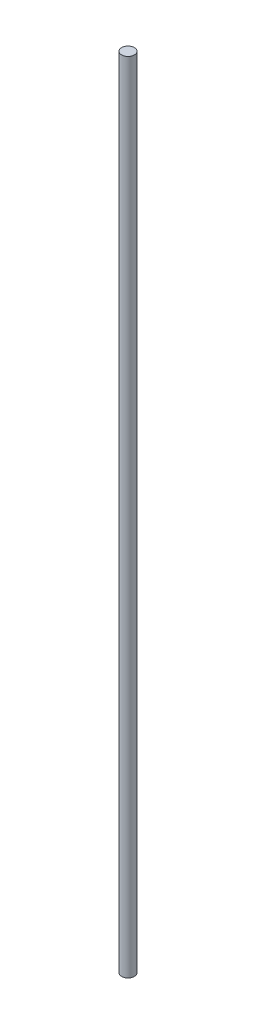
from build123d import *

# Parameters (mm, degrees)
SKETCH1_R           = 8
BOSS_EXTRUDE1_DEPTH = 1000


with BuildPart() as part:
    # Sketch1 → Boss-Extrude1 (new body)
    with BuildSketch(Plane(origin=(0, 0, 0), x_dir=(1, 0, 0), z_dir=(0, 1, 0))):
        with Locations(Location((0, 0, 0), (0, 0, 270))):
            Circle(SKETCH1_R)
    extrude(amount=BOSS_EXTRUDE1_DEPTH)


solid = part.part
